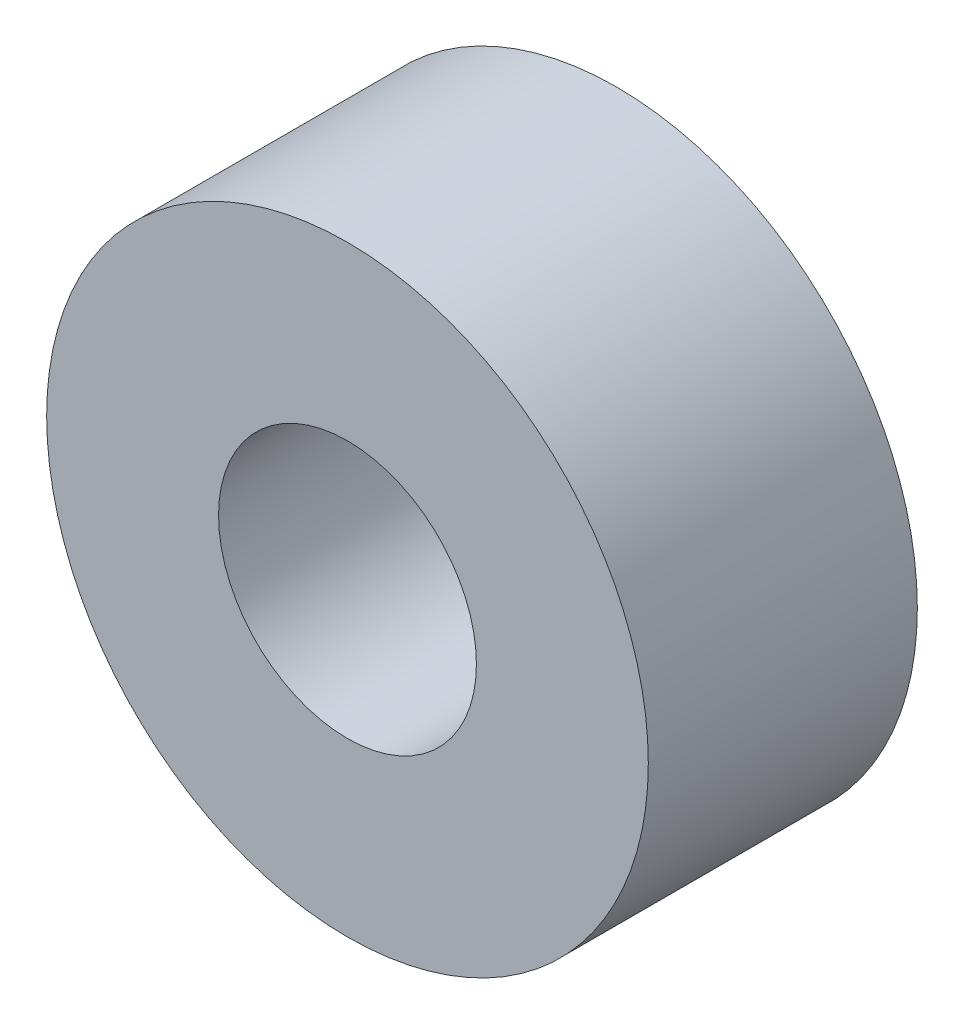
from build123d import *

# Parameters (mm, degrees)
SKETCH1_R           = 8.89
SKETCH1_R_2         = 3.81
BOSS_EXTRUDE1_DEPTH = 7.9502


with BuildPart() as part:
    # Sketch1 → Boss-Extrude1 (new body)
    with BuildSketch(Plane.XY):
        Circle(SKETCH1_R)
        Circle(SKETCH1_R_2, mode=Mode.SUBTRACT)
    extrude(amount=BOSS_EXTRUDE1_DEPTH)


solid = part.part
